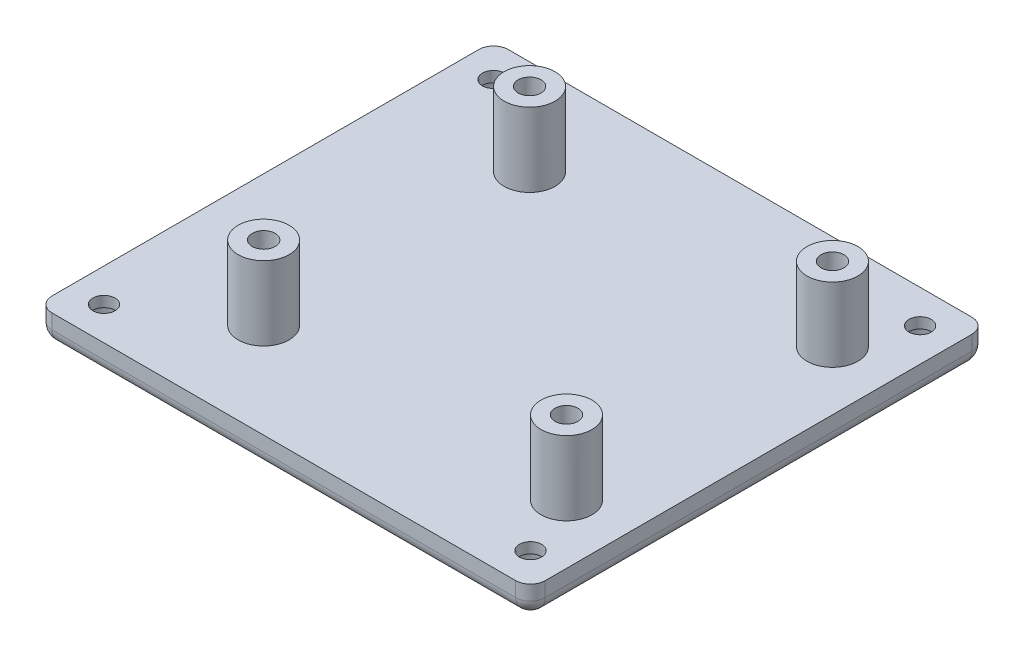
from build123d import *

# Parameters (mm, degrees)
SKETCH1_W                    = 66.76
SKETCH1_H                    = 61.76
BOSS_EXTRUDE3_DEPTH          = 4
SKETCH2_R                    = 3.45
SKETCH2_R_2                  = 1.55
BOSS_EXTRUDE4_DEPTH          = 10
SKETCH3_R                    = 1.5
CUT_EXTRUDE1_DEPTH           = 3
CUT_EXTRUDE1_DRAFT           = 3
CUT_EXTRUDE1_PROFILE_2_DEPTH = 3
CUT_EXTRUDE1_PROFILE_2_DRAFT = 3
CUT_EXTRUDE1_PROFILE_3_DEPTH = 3
CUT_EXTRUDE1_PROFILE_3_DRAFT = 3
CUT_EXTRUDE1_PROFILE_4_DEPTH = 3
CUT_EXTRUDE1_PROFILE_4_DRAFT = 3
FILLET2_R                    = 2
FILLET1_R                    = 2
SKETCH5_R                    = 3.15
CUT_EXTRUDE2_DEPTH           = 2.5
CUT_EXTRUDE2_DRAFT           = -1
CUT_EXTRUDE2_PROFILE_2_DEPTH = 2.5
CUT_EXTRUDE2_PROFILE_2_DRAFT = -1
CUT_EXTRUDE2_PROFILE_3_DEPTH = 2.5
CUT_EXTRUDE2_PROFILE_3_DRAFT = -1
CUT_EXTRUDE2_PROFILE_4_DEPTH = 2.5
CUT_EXTRUDE2_PROFILE_4_DRAFT = -1


with BuildPart() as part:
    # Sketch1 → Boss-Extrude3 (new body)
    with BuildSketch(Plane(origin=(0, 0, 0), x_dir=(1, 0, 0), z_dir=(0, 1, 0))):
        with Locations((33.38, 30.88)):
            Rectangle(SKETCH1_W, SKETCH1_H)
    extrude(amount=-BOSS_EXTRUDE3_DEPTH)

    # Sketch2 → Boss-Extrude4 (add)
    # profile 1 of 4: a face of its own
    with BuildSketch(Plane(origin=(0, 0, 0), x_dir=(1, 0, 0), z_dir=(0, 1, 0))):
        with Locations(Location((58.76, 12.88, 0), (0, 0, 90))):
            Circle(SKETCH2_R)
        with Locations(Location((58.76, 12.88, 0), (0, 0, 270))):
            Circle(SKETCH2_R_2, mode=Mode.SUBTRACT)
    # profile 2 of 4: a face of its own
    with BuildSketch(Plane(origin=(0, 0, 0), x_dir=(1, 0, 0), z_dir=(0, 1, 0))):
        with Locations(Location((17.76, 12.88, 0), (0, 0, 90))):
            Circle(SKETCH2_R)
        with Locations(Location((17.76, 12.88, 0), (0, 0, 90))):
            Circle(SKETCH2_R_2, mode=Mode.SUBTRACT)
    # profile 3 of 4: a face of its own
    with BuildSketch(Plane(origin=(0, 0, 0), x_dir=(1, 0, 0), z_dir=(0, 1, 0))):
        with Locations(Location((58.76, 48.88, 0), (0, 0, 90))):
            Circle(SKETCH2_R)
        with Locations(Location((58.76, 48.88, 0), (0, 0, 90))):
            Circle(SKETCH2_R_2, mode=Mode.SUBTRACT)
    # profile 4 of 4: a face of its own
    with BuildSketch(Plane(origin=(0, 0, 0), x_dir=(1, 0, 0), z_dir=(0, 1, 0))):
        with Locations(Location((17.76, 48.88, 0), (0, 0, 90))):
            Circle(SKETCH2_R)
        with Locations(Location((17.76, 48.88, 0), (0, 0, 270))):
            Circle(SKETCH2_R_2, mode=Mode.SUBTRACT)
    extrude(amount=BOSS_EXTRUDE4_DEPTH)


with BuildPart() as cut_extrude1_tool:
    # Sketch3 → Cut-Extrude1 (with draft: the straight prism first)
    with BuildSketch(Plane(origin=(0, 0, 0), x_dir=(1, 0, 0), z_dir=(0, 1, 0))):
        with Locations((4.51, 57.25)):
            Circle(SKETCH3_R)
    extrude(amount=-CUT_EXTRUDE1_DEPTH)
    # Cut-Extrude1: the draft: its side faces are tilted about the plane it starts from
    cut_extrude1_sides = [cut_extrude1_tool.faces().sort_by_distance(p)[0] for p in [
        (3.01, -1.5, -57.25),
    ]]
    draft(cut_extrude1_sides, Plane(origin=(0, 0, 0), x_dir=(1, 0, 0), z_dir=(0, 1, 0)), CUT_EXTRUDE1_DRAFT)


with BuildPart() as part_1:
    add(part.part)

    # Cut-Extrude1: cut by cut_extrude1_tool
    add(cut_extrude1_tool.part, mode=Mode.SUBTRACT)


with BuildPart() as cut_extrude1_profile_2_tool:
    # Sketch3 → Cut-Extrude1 profile 2 (with draft: the straight prism first)
    with BuildSketch(Plane(origin=(0, 0, 0), x_dir=(1, 0, 0), z_dir=(0, 1, 0))):
        with Locations((62.25, 57.25)):
            Circle(SKETCH3_R)
    extrude(amount=-CUT_EXTRUDE1_PROFILE_2_DEPTH)
    # Cut-Extrude1 profile 2: the draft: its side faces are tilted about the plane it starts from
    cut_extrude1_profile_2_sides = [cut_extrude1_profile_2_tool.faces().sort_by_distance(p)[0] for p in [
        (60.75, -1.5, -57.25),
    ]]
    draft(cut_extrude1_profile_2_sides, Plane(origin=(0, 0, 0), x_dir=(1, 0, 0), z_dir=(0, 1, 0)), CUT_EXTRUDE1_PROFILE_2_DRAFT)


with BuildPart() as part_2:
    add(part_1.part)

    # Cut-Extrude1 profile 2: cut by cut_extrude1_profile_2_tool
    add(cut_extrude1_profile_2_tool.part, mode=Mode.SUBTRACT)


with BuildPart() as cut_extrude1_profile_3_tool:
    # Sketch3 → Cut-Extrude1 profile 3 (with draft: the straight prism first)
    with BuildSketch(Plane(origin=(0, 0, 0), x_dir=(1, 0, 0), z_dir=(0, 1, 0))):
        with Locations((62.25, 4.51)):
            Circle(SKETCH3_R)
    extrude(amount=-CUT_EXTRUDE1_PROFILE_3_DEPTH)
    # Cut-Extrude1 profile 3: the draft: its side faces are tilted about the plane it starts from
    cut_extrude1_profile_3_sides = [cut_extrude1_profile_3_tool.faces().sort_by_distance(p)[0] for p in [
        (60.75, -1.5, -4.51),
    ]]
    draft(cut_extrude1_profile_3_sides, Plane(origin=(0, 0, 0), x_dir=(1, 0, 0), z_dir=(0, 1, 0)), CUT_EXTRUDE1_PROFILE_3_DRAFT)


with BuildPart() as part_3:
    add(part_2.part)

    # Cut-Extrude1 profile 3: cut by cut_extrude1_profile_3_tool
    add(cut_extrude1_profile_3_tool.part, mode=Mode.SUBTRACT)


with BuildPart() as cut_extrude1_profile_4_tool:
    # Sketch3 → Cut-Extrude1 profile 4 (with draft: the straight prism first)
    with BuildSketch(Plane(origin=(0, 0, 0), x_dir=(1, 0, 0), z_dir=(0, 1, 0))):
        with Locations((4.51, 4.51)):
            Circle(SKETCH3_R)
    extrude(amount=-CUT_EXTRUDE1_PROFILE_4_DEPTH)
    # Cut-Extrude1 profile 4: the draft: its side faces are tilted about the plane it starts from
    cut_extrude1_profile_4_sides = [cut_extrude1_profile_4_tool.faces().sort_by_distance(p)[0] for p in [
        (3.01, -1.5, -4.51),
    ]]
    draft(cut_extrude1_profile_4_sides, Plane(origin=(0, 0, 0), x_dir=(1, 0, 0), z_dir=(0, 1, 0)), CUT_EXTRUDE1_PROFILE_4_DRAFT)


with BuildPart() as part_4:
    add(part_3.part)

    # Cut-Extrude1 profile 4: cut by cut_extrude1_profile_4_tool
    add(cut_extrude1_profile_4_tool.part, mode=Mode.SUBTRACT)

    # Fillet2
    fillet2_edges = [part_4.edges().sort_by_distance(p)[0] for p in [
        (0, -2, -61.76),
        (66.76, -2, -61.76),
        (66.76, -2, 0),
        (0, -2, 0),
    ]]
    fillet(fillet2_edges, radius=FILLET2_R)

    # Fillet1
    fillet1_edges = [part_4.edges().sort_by_distance(p)[0] for p in [
        (0, -4, -30.88),
        (33.38, -4, 0),
        (33.38, -4, -61.76),
        (66.76, -4, -30.88),
        (0.585786438, -4, -61.174213562),
        (66.174213562, -4, -61.174213562),
        (66.174213562, -4, -0.585786438),
        (0.585786438, -4, -0.585786438),
    ]]
    fillet(fillet1_edges, radius=FILLET1_R)


with BuildPart() as cut_extrude2_tool:
    # Sketch5 → Cut-Extrude2 (with draft: the straight prism first)
    with BuildSketch(Plane.XZ.offset(4)):
        with Locations((4.51, -4.51)):
            Circle(SKETCH5_R)
    extrude(amount=-CUT_EXTRUDE2_DEPTH)
    # Cut-Extrude2: the draft: its side faces are tilted about the plane it starts from
    cut_extrude2_sides = [cut_extrude2_tool.faces().sort_by_distance(p)[0] for p in [
        (1.36, -2.75, -4.51),
    ]]
    draft(cut_extrude2_sides, Plane.XZ.offset(4), CUT_EXTRUDE2_DRAFT)


with BuildPart() as part_5:
    add(part_4.part)

    # Cut-Extrude2: cut by cut_extrude2_tool
    add(cut_extrude2_tool.part, mode=Mode.SUBTRACT)


with BuildPart() as cut_extrude2_profile_2_tool:
    # Sketch5 → Cut-Extrude2 profile 2 (with draft: the straight prism first)
    with BuildSketch(Plane.XZ.offset(4)):
        with Locations((62.25, -4.51)):
            Circle(SKETCH5_R)
    extrude(amount=-CUT_EXTRUDE2_PROFILE_2_DEPTH)
    # Cut-Extrude2 profile 2: the draft: its side faces are tilted about the plane it starts from
    cut_extrude2_profile_2_sides = [cut_extrude2_profile_2_tool.faces().sort_by_distance(p)[0] for p in [
        (59.1, -2.75, -4.51),
    ]]
    draft(cut_extrude2_profile_2_sides, Plane.XZ.offset(4), CUT_EXTRUDE2_PROFILE_2_DRAFT)


with BuildPart() as part_6:
    add(part_5.part)

    # Cut-Extrude2 profile 2: cut by cut_extrude2_profile_2_tool
    add(cut_extrude2_profile_2_tool.part, mode=Mode.SUBTRACT)


with BuildPart() as cut_extrude2_profile_3_tool:
    # Sketch5 → Cut-Extrude2 profile 3 (with draft: the straight prism first)
    with BuildSketch(Plane.XZ.offset(4)):
        with Locations((62.25, -57.25)):
            Circle(SKETCH5_R)
    extrude(amount=-CUT_EXTRUDE2_PROFILE_3_DEPTH)
    # Cut-Extrude2 profile 3: the draft: its side faces are tilted about the plane it starts from
    cut_extrude2_profile_3_sides = [cut_extrude2_profile_3_tool.faces().sort_by_distance(p)[0] for p in [
        (59.1, -2.75, -57.25),
    ]]
    draft(cut_extrude2_profile_3_sides, Plane.XZ.offset(4), CUT_EXTRUDE2_PROFILE_3_DRAFT)


with BuildPart() as part_7:
    add(part_6.part)

    # Cut-Extrude2 profile 3: cut by cut_extrude2_profile_3_tool
    add(cut_extrude2_profile_3_tool.part, mode=Mode.SUBTRACT)


with BuildPart() as cut_extrude2_profile_4_tool:
    # Sketch5 → Cut-Extrude2 profile 4 (with draft: the straight prism first)
    with BuildSketch(Plane.XZ.offset(4)):
        with Locations((4.51, -57.25)):
            Circle(SKETCH5_R)
    extrude(amount=-CUT_EXTRUDE2_PROFILE_4_DEPTH)
    # Cut-Extrude2 profile 4: the draft: its side faces are tilted about the plane it starts from
    cut_extrude2_profile_4_sides = [cut_extrude2_profile_4_tool.faces().sort_by_distance(p)[0] for p in [
        (1.36, -2.75, -57.25),
    ]]
    draft(cut_extrude2_profile_4_sides, Plane.XZ.offset(4), CUT_EXTRUDE2_PROFILE_4_DRAFT)


with BuildPart() as part_8:
    add(part_7.part)

    # Cut-Extrude2 profile 4: cut by cut_extrude2_profile_4_tool
    add(cut_extrude2_profile_4_tool.part, mode=Mode.SUBTRACT)


solid = part_8.part
